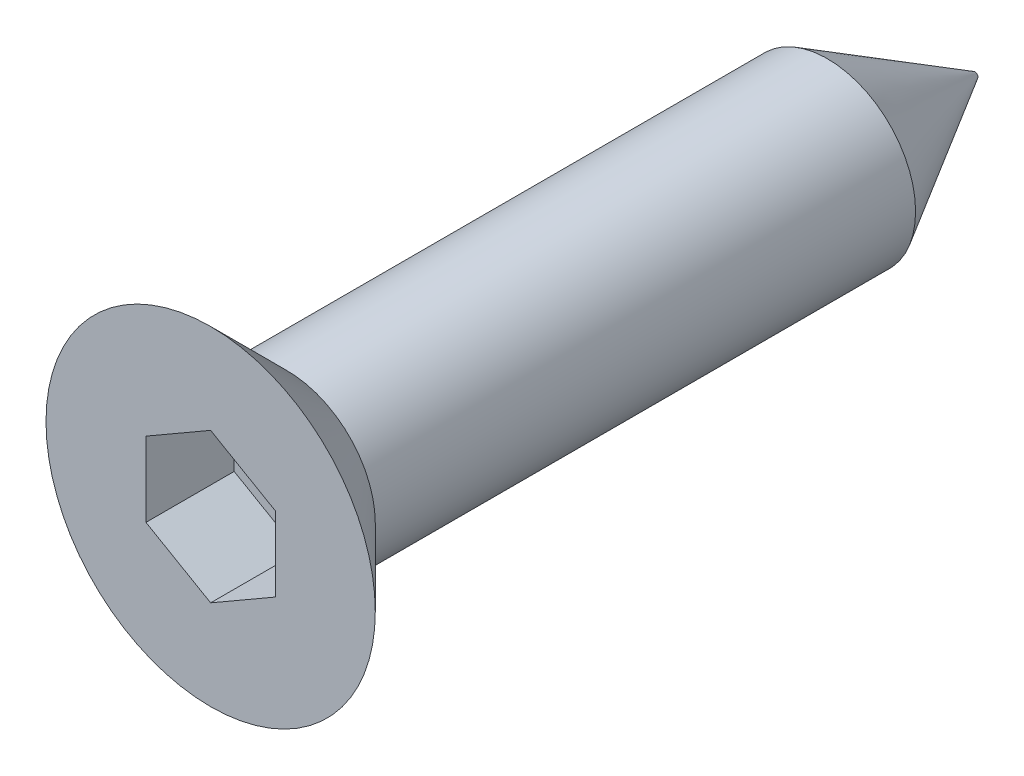
from build123d import *

# Parameters (mm, degrees)
ESQUISSE3_R             = 1.5
EXTRUSION1_DEPTH        = 13
ENL_V_MAT_EXTRU_2_DEPTH = 1.5
CHANFREIN1_SIZE         = 1.45
CHANFREIN1_SIZE2        = 2.511473671


with BuildPart() as part:
    # Esquisse1 → Révolution2 (revolve)
    with BuildSketch(Plane(origin=(0, 0, 0), x_dir=(0, 0, -1), z_dir=(1, 0, 0)), mode=Mode.PRIVATE) as r_volution2_sk:
        Polygon((0, 2.8), (1.3, 1.5), (1.3, 0), (0, 0), align=None)
    revolve(r_volution2_sk.sketch.rotate(Axis((0, 0, 1.603508429), (0, 0, -1)), 90), axis=Axis((0, 0, 1.603508429), (0, 0, -1)))

    # Esquisse3 → Extrusion1 (add)
    with BuildSketch(Plane.XY):
        Circle(ESQUISSE3_R)
    extrude(amount=-EXTRUSION1_DEPTH)

    # Esquisse2 → Enlèv. mat.-Extru.2 (cut)
    with BuildSketch(Plane.XY):
        Polygon((0, 1.270170592), (-1.1, 0.635085296), (-1.1, -0.635085296), (0, -1.270170592), (1.1, -0.635085296), (1.1, 0.635085296), align=None)
    extrude(amount=-ENL_V_MAT_EXTRU_2_DEPTH, mode=Mode.SUBTRACT)

    # Chanfrein1
    chanfrein1_edges = [part.edges().sort_by_distance(p)[0] for p in [
        (-1.5, 0, -13),
    ]]
    chanfrein1_side = [part.faces().sort_by_distance(p)[0] for p in [
        (0, 0, -13),
    ]]
    chamfer(chanfrein1_edges, length=CHANFREIN1_SIZE, length2=CHANFREIN1_SIZE2, reference=chanfrein1_side[0])


solid = part.part
